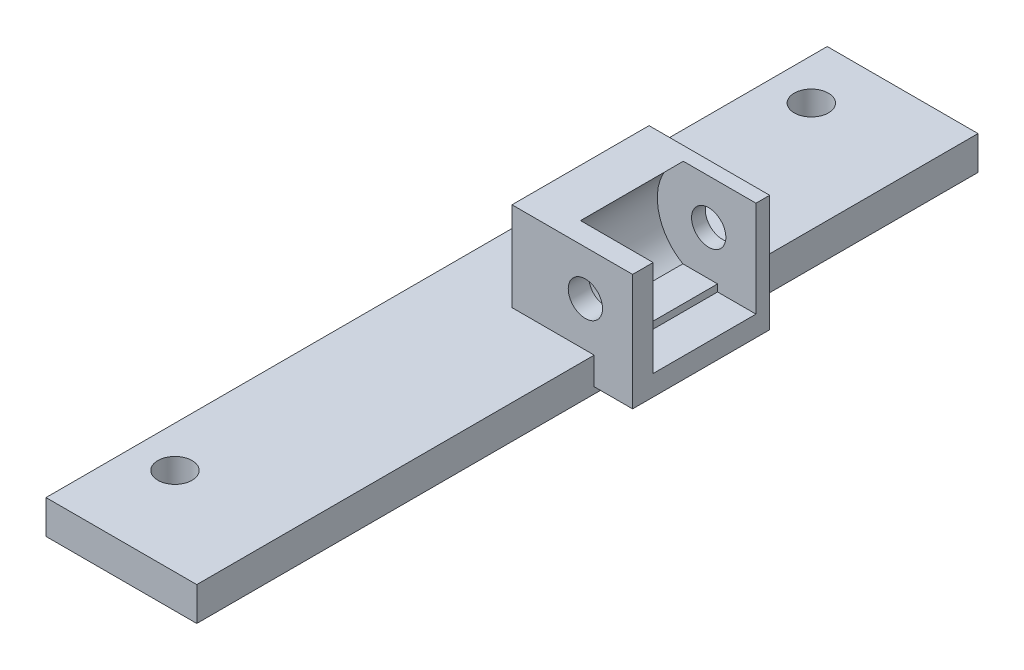
from build123d import *

# Parameters (mm, degrees)
BOSS_EXTRUDE1_DEPTH      = 21.59
SKETCH2_W                = 22.352
SKETCH2_H                = 21.59
SKETCH2_R                = 3.175
BOSS_EXTRUDE2_DEPTH      = 3.81
BOSS_EXTRUDE3_START      = -2.54
SKETCH3_R                = 3.175
BOSS_EXTRUDE3_DEPTH      = 2.54
BOSS_EXTRUDE4_DEPTH      = 1.164777
BOSS_EXTRUDE4_DEPTH_BACK = 5.08
SKETCH4_W                = 27.94
SKETCH4_H                = 144.78
SKETCH4_R                = 3.175


with BuildPart() as part:
    # Sketch1 → Boss-Extrude1 (new body)
    with BuildSketch(Plane.XY):
        with BuildLine():
            Line((-792.583825879, 92.376177143), (-792.583825879, 96.160777143))
            Line((-792.583825879, 96.160777143), (-801.338321143, 96.160777143))
            ThreePointArc((-801.338321143, 96.160777143), (-803.772947911, 96.477182381), (-806.045825879, 97.405377143))
            ThreePointArc((-806.045825879, 97.405377143), (-810.863321143, 105.685777143), (-806.045825879, 113.966177143))
            Line((-806.045825879, 113.966177143), (-814.935825879, 113.966177143))
            Line((-814.935825879, 113.966177143), (-814.935825879, 92.376177143))
            Line((-814.935825879, 92.376177143), (-792.583825879, 92.376177143))
        make_face()
    extrude(amount=-BOSS_EXTRUDE1_DEPTH)

    # Sketch2 → Boss-Extrude2 (add)
    with BuildSketch(Plane.XY):
        with Locations((-803.759825879, 103.171177143)):
            Rectangle(SKETCH2_W, SKETCH2_H)
        with Locations(Location((-801.338321143, 105.685777143, 0), (0, 0, 180))):
            Circle(SKETCH2_R, mode=Mode.SUBTRACT)
    extrude(amount=BOSS_EXTRUDE2_DEPTH)

    # Sketch3 → Boss-Extrude3 (add)
    with BuildSketch(Plane(origin=(0, 0, -21.59), x_dir=(-1, 0, 0), z_dir=(0, 0, -1)).offset(BOSS_EXTRUDE3_START)):
        with BuildLine():
            Line((792.583825879, 113.966177143), (792.583825879, 96.160777143))
            Line((792.583825879, 96.160777143), (801.338321143, 96.160777143))
            ThreePointArc((801.338321143, 96.160777143), (810.546915906, 103.251150375), (806.045825879, 113.966177143))
            Line((806.045825879, 113.966177143), (792.583825879, 113.966177143))
        make_face()
        with Locations((801.338321143, 105.685777143)):
            Circle(SKETCH3_R, mode=Mode.SUBTRACT)
    extrude(amount=BOSS_EXTRUDE3_DEPTH)

    # Sketch4 → Boss-Extrude4 (add, two sides: drawn at the far end of the back side and taken through both)
    with BuildSketch(Plane.XZ.offset(-92.376177143).offset(-BOSS_EXTRUDE4_DEPTH_BACK)):
        with Locations((-813.665825879, 5.08)):
            Rectangle(SKETCH4_W, SKETCH4_H)
        with Locations(Location((-820.039, -56.765714286, 0), (0, 0, 270))):
            Circle(SKETCH4_R, mode=Mode.SUBTRACT)
        with Locations(Location((-820.039, 61.162857143, 0), (0, 0, 270))):
            Circle(SKETCH4_R, mode=Mode.SUBTRACT)
    extrude(amount=BOSS_EXTRUDE4_DEPTH + BOSS_EXTRUDE4_DEPTH_BACK)


solid = part.part
